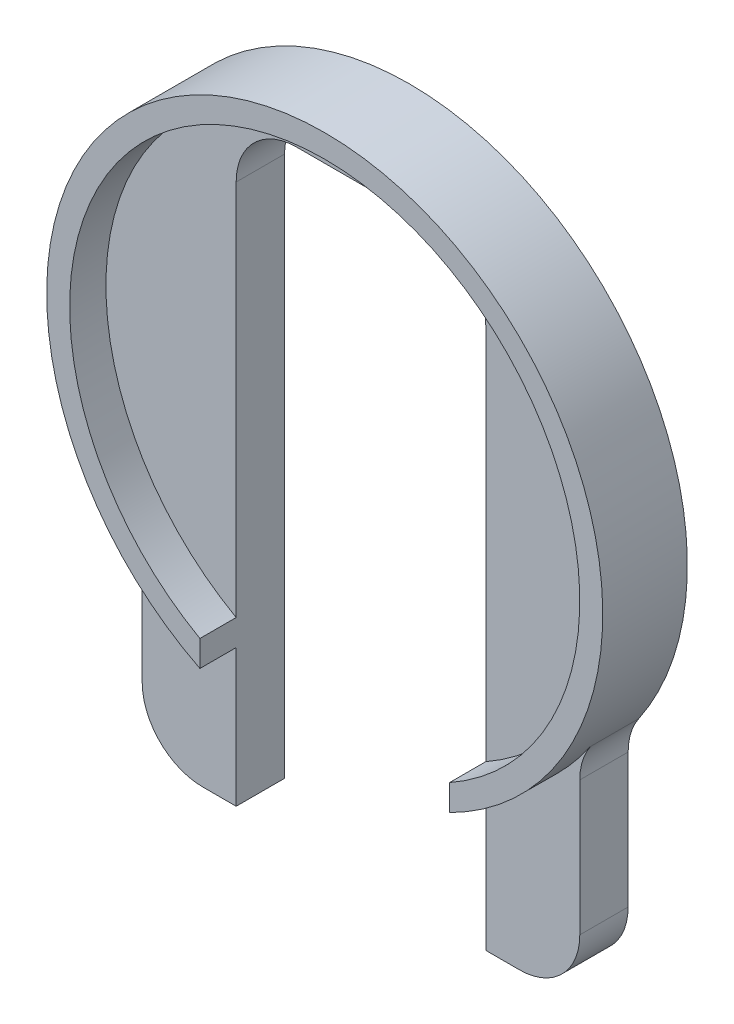
from build123d import *

# Parameters (mm, degrees)
BOSS_EXTRUDE1_DEPTH = 4
BOSS_EXTRUDE2_DEPTH = 3
FILLET1_R           = 5
FILLET2_R           = 5


with BuildPart() as part:
    # Sketch1 → Boss-Extrude1 (new body)
    with BuildSketch(Plane.XY):
        with BuildLine():
            Line((-10.325, 10.325), (-10.325, -31.925))
            Line((-10.325, -31.925), (-18.1, -31.925))
            Line((-18.1, -31.925), (-18.1, -14.191194453))
            ThreePointArc((-18.1, -14.191194453), (0, 23), (18.1, -14.191194453))
            Line((18.1, -14.191194453), (18.1, -31.925))
            Line((18.1, -31.925), (10.325, -31.925))
            Line((10.325, -31.925), (10.325, 10.325))
            Line((10.325, 10.325), (10.325, 17.8))
            Line((10.325, 17.8), (-10.325, 17.8))
            Line((-10.325, 17.8), (-10.325, 10.325))
        make_face()
    extrude(amount=BOSS_EXTRUDE1_DEPTH)

    # Sketch2 → Boss-Extrude2 (add)
    with BuildSketch(Plane.XY.offset(4)):
        with BuildLine():
            Line((-10.325, -18.401205803), (-10.325, -20.55223528))
            ThreePointArc((-10.325, -20.55223528), (0, 23), (10.325, -20.55223528))
            Line((10.325, -20.55223528), (10.325, -18.401205803))
            ThreePointArc((10.325, -18.401205803), (0, 21.1), (-10.325, -18.401205803))
        make_face()
    extrude(amount=BOSS_EXTRUDE2_DEPTH)

    # Fillet1
    fillet1_edges = [part.edges().sort_by_distance(p)[0] for p in [
        (10.325, 17.8, 2),
        (-10.325, 17.8, 2),
    ]]
    fillet(fillet1_edges, radius=FILLET1_R)

    # Fillet2
    fillet2_edges = [part.edges().sort_by_distance(p)[0] for p in [
        (18.1, -31.925, 2),
        (-18.1, -31.925, 2),
        (-18.1, -14.191194453, 2),
        (18.1, -14.191194453, 2),
    ]]
    fillet(fillet2_edges, radius=FILLET2_R)


solid = part.part
